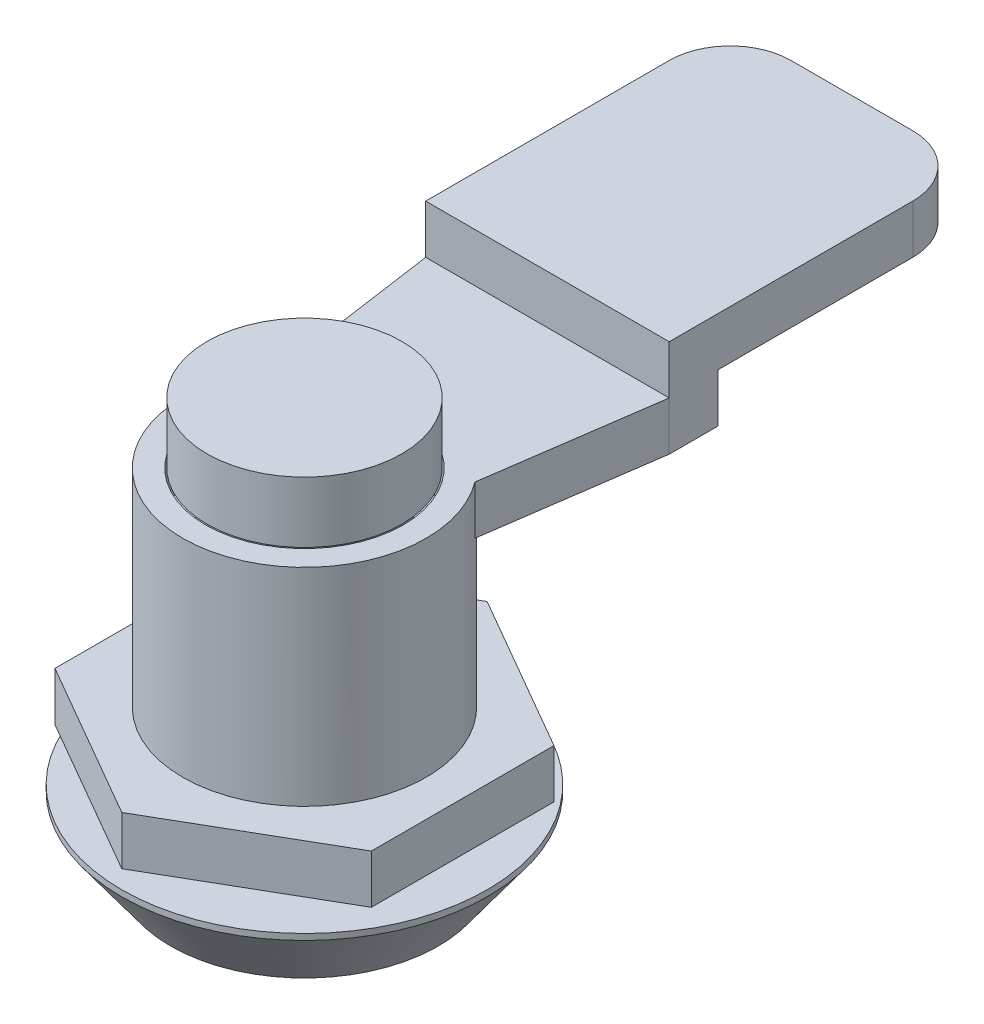
from build123d import *

# Parameters (mm, degrees)
EXTRUDE_START       = 4
SKETCH_2_R          = 8.114467409
EXTRUDE_1_DEPTH     = 4
SKETCH_4_R          = 9.25
CUT_EXTRUDE_1_DEPTH = 5
SKETCH_5_OUTSIDE_W  = 43.9
SKETCH_5_OUTSIDE_H  = 52.854
CUT_EXTRUDE_7_DEPTH = 4
EXTRUDE_3_DEPTH     = 5
SKETCH_9_W          = 20
SKETCH_9_H          = 4
EXTRUDE_4_DEPTH     = 21
SKETCH_11_W         = 20
SKETCH_11_H         = 4
EXTRUDE_5_DEPTH     = 4
FILLET_1_R          = 5


with BuildPart() as part:
    # Эскиз1 → Повернуть1 (revolve)
    with BuildSketch(Plane.XY, mode=Mode.PRIVATE) as revolve_1_sk:
        Polygon((0, 0), (11, 0), (15, 5.5), (15, 6), (10, 6), (10, 7.5), (15, 7.5), (15, 11.5), (10, 11.5), (10, 24.5), (6.326264721, 24.5), (6.326264721, 28.5), (8, 28.5), (8, 33.5), (0, 33.5), align=None)
    revolve(revolve_1_sk.sketch.rotate(Axis((0, 38.134324324, 0), (0, -1, 0)), 90), axis=Axis((0, 38.134324324, 0), (0, -1, 0)))

    # Эскиз2 → Вытянуть1 (add)
    with BuildSketch(Plane(origin=(0, 24.5, 0), x_dir=(1, 0, 0), z_dir=(0, 1, 0)).offset(EXTRUDE_START)):
        with BuildLine():
            Line((-8, 6), (-10, 19.953992765))
            Line((-10, 19.953992765), (-10, 23.953992765))
            Line((-10, 23.953992765), (10, 23.953992765))
            Line((10, 23.953992765), (10, 19.953992765))
            Line((10, 19.953992765), (8, 6))
            ThreePointArc((8, 6), (0, -10), (-8, 6))
        make_face()
        with Locations(Location((0, 0, 0), (0, 0, 270))):
            Circle(SKETCH_2_R, mode=Mode.SUBTRACT)
    extrude(amount=-EXTRUDE_1_DEPTH)

    # Эскиз4 → Вырез-Вытянуть1 (cut)
    with BuildSketch(Plane.XZ):
        with Locations(Location((0, 0, 0), (0, 0, 270))):
            Circle(SKETCH_4_R)
    extrude(amount=-CUT_EXTRUDE_1_DEPTH, mode=Mode.SUBTRACT)

    # Эскиз5 outside → Вырез-Вытянуть7 (cut)
    with BuildSketch(Plane(origin=(0, 11.5, 0), x_dir=(1, 0, 0), z_dir=(0, 1, 0))):
        with Locations((0, 4.477)):
            Rectangle(SKETCH_5_OUTSIDE_W, SKETCH_5_OUTSIDE_H)
        Polygon((0, -15), (12.990381057, -7.5), (12.990381057, 7.5), (0, 15), (-12.990381057, 7.5), (-12.990381057, -7.5), align=None, mode=Mode.SUBTRACT)
    extrude(amount=-CUT_EXTRUDE_7_DEPTH, mode=Mode.SUBTRACT)

    # Эскиз6 → Вытянуть3 (add)
    with BuildSketch(Plane.XZ.offset(-5)):
        Polygon((-4.5, -3.897114317), (0, 3.897114317), (4.5, -3.897114317), align=None)
    extrude(amount=EXTRUDE_3_DEPTH)



with BuildPart() as body_2:
    # Эскиз9 → Вытянуть4 (new body)
    with BuildSketch(Plane(origin=(0, 0, -23.953992765), x_dir=(-1, 0, 0), z_dir=(0, 0, -1))):
        with Locations((0, 30.5)):
            Rectangle(SKETCH_9_W, SKETCH_9_H)
    extrude(amount=EXTRUDE_4_DEPTH)


with BuildPart() as part_1:
    add(part.part)

    add(body_2.part)  # Вытянуть5 merges body 2
    # Эскиз11 → Вытянуть5 (add)
    with BuildSketch(Plane.XY.offset(-23.953992765)):
        with Locations((0, 30.5)):
            Rectangle(SKETCH_11_W, SKETCH_11_H)
    extrude(amount=EXTRUDE_5_DEPTH)

    # Скругление1
    fillet_1_edges = [part_1.edges().sort_by_distance(p)[0] for p in [
        (10, 30.5, -44.953992765),
        (-10, 30.5, -44.953992765),
    ]]
    fillet(fillet_1_edges, radius=FILLET_1_R)


solid = part_1.part
